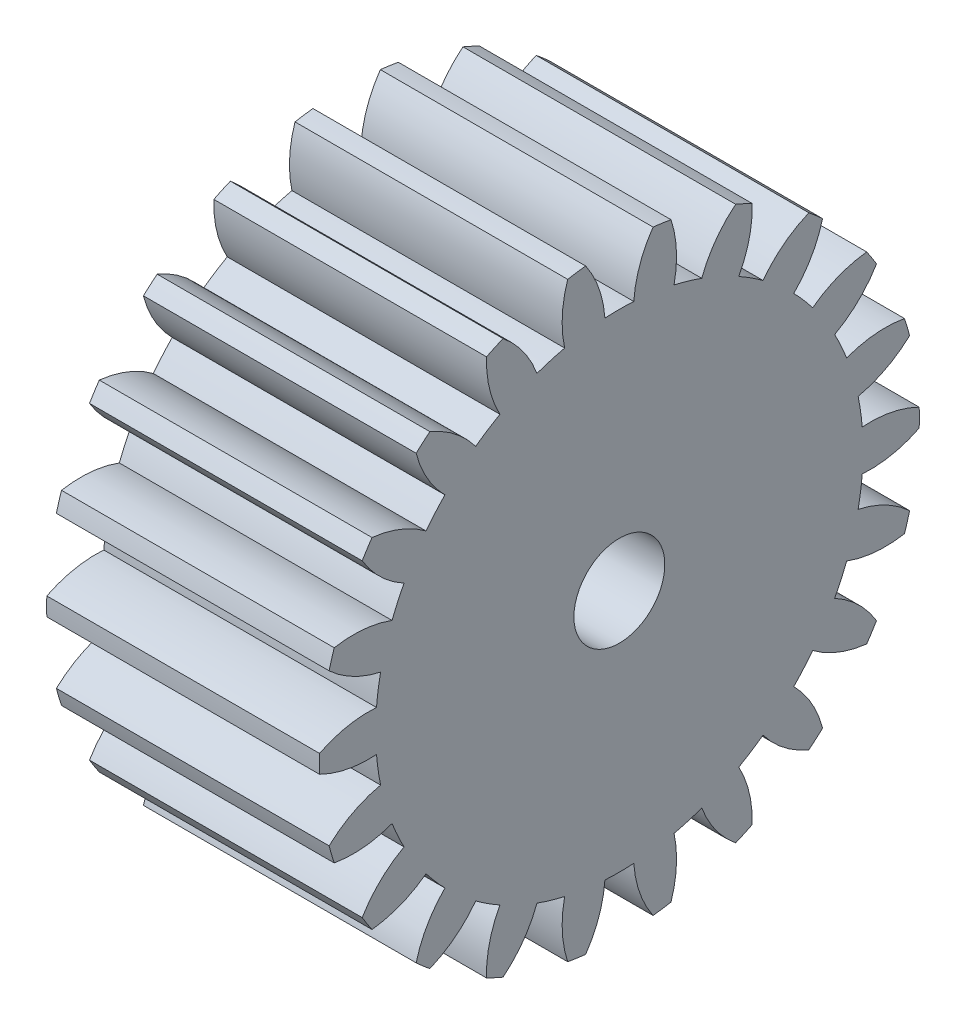
from build123d import *

# Parameters (mm, degrees)
BASPROSKE_W     = 15
BASPROSKE_H     = 16.5
TOOTHCUT_DEPTH  = 28.739863013
TEETHCUTS_COUNT = 22
BORSKE_R        = 2.5
BORE_DEPTH      = 50.0000508


with BuildPart() as part:
    # BasProSke → Base-Revolve (revolve)
    with BuildSketch(Plane(origin=(0, 0, 0), x_dir=(1, 0, 0), z_dir=(0, 1, 0)), mode=Mode.PRIVATE) as base_revolve_sk:
        with Locations((7.5, 8.25)):
            Rectangle(BASPROSKE_W, BASPROSKE_H)
    revolve(base_revolve_sk.sketch.rotate(Axis((-10, 0, 0), (1, 0, 0)), 180), axis=Axis((-10, 0, 0), (1, 0, 0)))

    # TooCutSke → ToothCut (cut, through all)
    with BuildSketch(Plane(origin=(0, 0, 0), x_dir=(0, 0, -1), z_dir=(1, 0, 0))):
        with BuildLine():
            ThreePointArc((0.79383235, 13.381724768), (0, 13.40525), (-0.79383235, 13.381724768))
            ThreePointArc((-0.79383235, 13.381724768), (-1.125821903, 14.973456057), (-1.869731633, 16.419285879))
            ThreePointArc((-1.869731633, 16.419285879), (0, 16.5254), (1.869731633, 16.419285879))
            ThreePointArc((1.869731633, 16.419285879), (1.125821903, 14.973456057), (0.79383235, 13.381724768))
        make_face()
    toothcut = extrude(amount=TOOTHCUT_DEPTH, mode=Mode.SUBTRACT)

    # TeethCuts: ToothCut ×22 about axis
    teethcuts_axis = Axis((0, 0, 0), (1, 0, 0))
    for i in range(1, TEETHCUTS_COUNT):
        add(toothcut.rotate(teethcuts_axis, i * 360 / TEETHCUTS_COUNT), mode=Mode.SUBTRACT)

    # BorSke → Bore (cut, symmetric)
    with BuildSketch(Plane(origin=(0, 0, 0), x_dir=(0, 0, -1), z_dir=(1, 0, 0))):
        with Locations(Location((0, 0, 0), (0, 0, 180))):
            Circle(BORSKE_R)
    extrude(amount=BORE_DEPTH, both=True, mode=Mode.SUBTRACT)


solid = part.part
